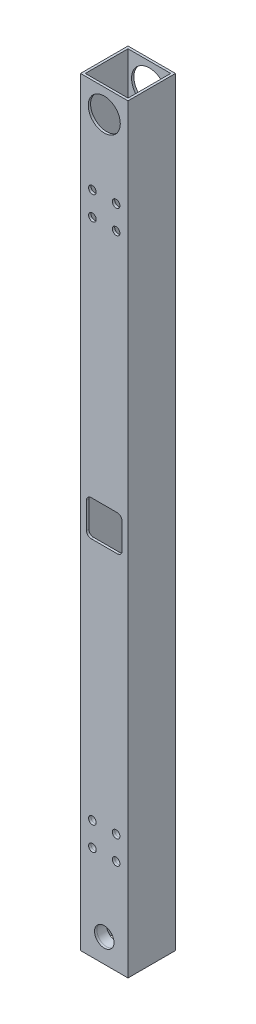
from build123d import *

# Parameters (mm, degrees)
SKETCH_1_W                      = 20
SKETCH_1_H                      = 20
SKETCH_1_W_2                    = 18
SKETCH_1_H_2                    = 18
EXTRUDE_1_DEPTH                 = 320
SKETCH_2_R                      = 1.6
CUT_EXTRUDE_1_DEPTH             = 322.247568084
CUT_EXTRUDE_2_REACH             = 323.248
SKETCH_4_R                      = 4.1
SKETCH_4_R_2                    = 6.75
CUT_EXTRUDE_3_DEPTH             = 322.247568084
CUT_EXTRUDE_4_REACH             = 323.248
SKETCH_5_R                      = 7.5
CUT_EXTRUDE_4_DIRECTION_2_DEPTH = 322.247568084
SKETCH_8_W                      = 17.8
SKETCH_8_H                      = 60
SKETCH_8_R                      = 4.1
EXTRUDE_3_DEPTH                 = 4
SKETCH_9_R                      = 1.6
CUT_EXTRUDE_5_DEPTH             = 322.247568084
SKETCH_10_R                     = 4
CUT_EXTRUDE_6_DEPTH             = 1


with BuildPart() as part:
    # 草图1 → 凸台-拉伸1 (new body)
    with BuildSketch(Plane(origin=(0, 0, 0), x_dir=(1, 0, 0), z_dir=(0, 1, 0))):
        with Locations((10, 10)):
            Rectangle(SKETCH_1_W, SKETCH_1_H)
        with Locations((10, 10)):
            Rectangle(SKETCH_1_W_2, SKETCH_1_H_2, mode=Mode.SUBTRACT)
    extrude(amount=EXTRUDE_1_DEPTH)

    # 草图2 → 切除-拉伸1 (cut, through all)
    with BuildSketch(Plane(origin=(0, 0, -20), x_dir=(-1, 0, 0), z_dir=(0, 0, -1))):
        with Locations((-14.949747468, 155.050252532)):
            Circle(SKETCH_2_R)
        with Locations((-14.949747468, 164.949747468)):
            Circle(SKETCH_2_R)
        with Locations((-5.050252532, 164.949747468)):
            Circle(SKETCH_2_R)
        with Locations((-5.050252532, 155.050252532)):
            Circle(SKETCH_2_R)
    extrude(amount=-CUT_EXTRUDE_1_DEPTH, mode=Mode.SUBTRACT)

    # 草图3 → 切除-拉伸2 (cut, up to next)
    with BuildSketch(Plane.XY, mode=Mode.PRIVATE) as cut_extrude_2_sk1:
        with BuildLine():
            Line((4.5, 167.5), (15.5, 167.5))
            ThreePointArc((15.5, 167.5), (16.914213562, 166.914213562), (17.5, 165.5))
            Line((17.5, 165.5), (17.5, 154.5))
            ThreePointArc((17.5, 154.5), (16.914213562, 153.085786438), (15.5, 152.5))
            Line((15.5, 152.5), (4.5, 152.5))
            ThreePointArc((4.5, 152.5), (3.085786438, 153.085786438), (2.5, 154.5))
            Line((2.5, 154.5), (2.5, 165.5))
            ThreePointArc((2.5, 165.5), (3.085786438, 166.914213562), (4.5, 167.5))
        make_face()
    cut_extrude_2_tool1 = extrude(cut_extrude_2_sk1.sketch, amount=-CUT_EXTRUDE_2_REACH, mode=Mode.PRIVATE) & part.part
    add(cut_extrude_2_tool1.solids().sort_by_distance((10, 160, 0))[0], mode=Mode.SUBTRACT)

    # 草图4 → 切除-拉伸3 (cut, through all)
    with BuildSketch(Plane.XY):
        with Locations((10, 10)):
            Circle(SKETCH_4_R)
        with Locations((10, 310)):
            Circle(SKETCH_4_R_2)
    extrude(amount=-CUT_EXTRUDE_3_DEPTH, mode=Mode.SUBTRACT)

    # 草图5 → 切除-拉伸4 (cut, up to next)
    with BuildSketch(Plane(origin=(0, 0, -20), x_dir=(-1, 0, 0), z_dir=(0, 0, -1)), mode=Mode.PRIVATE) as cut_extrude_4_sk1:
        with Locations(Location((-10, 10, 0), (0, 0, 180))):
            Circle(SKETCH_5_R)
    cut_extrude_4_tool1 = extrude(cut_extrude_4_sk1.sketch, amount=-CUT_EXTRUDE_4_REACH, mode=Mode.PRIVATE) & part.part
    # 草图5 → 切除-拉伸4 (cut, up to next)
    with BuildSketch(Plane(origin=(0, 0, -20), x_dir=(-1, 0, 0), z_dir=(0, 0, -1)), mode=Mode.PRIVATE) as cut_extrude_4_sk2:
        with Locations(Location((-10, 310, 0), (0, 0, 180))):
            Circle(SKETCH_5_R)
    cut_extrude_4_tool2 = extrude(cut_extrude_4_sk2.sketch, amount=-CUT_EXTRUDE_4_REACH, mode=Mode.PRIVATE) & part.part
    add(cut_extrude_4_tool1.solids().sort_by_distance((10, 10, -20))[0], mode=Mode.SUBTRACT)
    add(cut_extrude_4_tool2.solids().sort_by_distance((10, 310, -20))[0], mode=Mode.SUBTRACT)

    # 草图5 → 切除-拉伸4 direction 2 (cut)
    with BuildSketch(Plane(origin=(0, 0, -20), x_dir=(-1, 0, 0), z_dir=(0, 0, -1))):
        with Locations(Location((-10, 10, 0), (0, 0, 180))):
            Circle(SKETCH_5_R)
        with Locations(Location((-10, 310, 0), (0, 0, 180))):
            Circle(SKETCH_5_R)
    extrude(amount=CUT_EXTRUDE_4_DIRECTION_2_DEPTH, mode=Mode.SUBTRACT)


with BuildPart() as body_2:
    # 草图8 → 凸台-拉伸3 (new body)
    with BuildSketch(Plane(origin=(0, 0, -1), x_dir=(-1, 0, 0), z_dir=(0, 0, -1))):
        with Locations((-10, 30)):
            Rectangle(SKETCH_8_W, SKETCH_8_H)
        with Locations((-10, 10)):
            Circle(SKETCH_8_R, mode=Mode.SUBTRACT)
    extrude(amount=EXTRUDE_3_DEPTH)


with BuildPart() as cut_extrude_5_tool:
    # 草图9 → 切除-拉伸5 (new, through all)
    with BuildSketch(Plane.XY):
        with Locations(Location((15, 40, 0), (0, 0, 180))):
            Circle(SKETCH_9_R)
        with Locations(Location((5, 40, 0), (0, 0, 180))):
            Circle(SKETCH_9_R)
        with Locations(Location((5, 50, 0), (0, 0, 180))):
            Circle(SKETCH_9_R)
        with Locations(Location((15, 50, 0), (0, 0, 180))):
            Circle(SKETCH_9_R)
        with Locations(Location((15, 280, 0), (0, 0, 180))):
            Circle(SKETCH_9_R)
        with Locations(Location((5, 280, 0), (0, 0, 180))):
            Circle(SKETCH_9_R)
        with Locations(Location((5, 270, 0), (0, 0, 180))):
            Circle(SKETCH_9_R)
        with Locations(Location((15, 270, 0), (0, 0, 180))):
            Circle(SKETCH_9_R)
    extrude(amount=-CUT_EXTRUDE_5_DEPTH)


with BuildPart() as part_1:
    add(part.part)

    # 切除-拉伸5: cut by cut_extrude_5_tool
    add(cut_extrude_5_tool.part, mode=Mode.SUBTRACT)

    # 草图10 → 切除-拉伸6 (cut)
    with BuildSketch(Plane(origin=(0, 0, -20), x_dir=(-1, 0, 0), z_dir=(0, 0, -1))):
        with Locations((-5, 50)):
            Circle(SKETCH_10_R)
        with Locations((-5, 40)):
            Circle(SKETCH_10_R)
        with Locations((-15, 50)):
            Circle(SKETCH_10_R)
        with Locations((-15, 40)):
            Circle(SKETCH_10_R)
        with Locations(Location((-15, 280, 0), (0, 0, 180))):
            Circle(SKETCH_10_R)
        with Locations(Location((-15, 270, 0), (0, 0, 180))):
            Circle(SKETCH_10_R)
        with Locations((-5, 280)):
            Circle(SKETCH_10_R)
        with Locations((-5, 270)):
            Circle(SKETCH_10_R)
    extrude(amount=-CUT_EXTRUDE_6_DEPTH, mode=Mode.SUBTRACT)


with BuildPart() as body_2_1:
    add(body_2.part)

    # 切除-拉伸5: cut by cut_extrude_5_tool
    add(cut_extrude_5_tool.part, mode=Mode.SUBTRACT)


solid = Compound([part_1.part, body_2_1.part])
